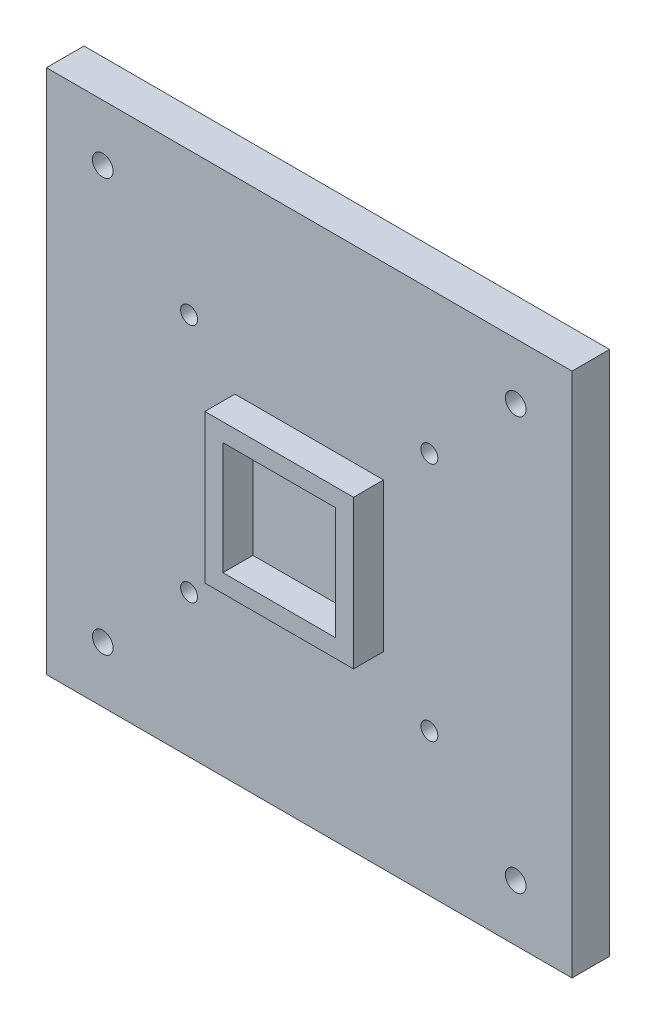
from build123d import *

# Parameters (mm, degrees)
SKETCH_1_W            = 140
SKETCH_1_H            = 140
EXTRUDE_140X140_DEPTH = 10
EXTRUDE_START         = 10
SKETCH_2_W            = 39.6
SKETCH_2_H            = 39.6
SKETCH_2_W_2          = 30
SKETCH_2_H_2          = 30
EXTRUDE_39P6_DEPTH    = 8
M5_M4_DEPTH           = 101.618089825
M5_M4_DEPTH_BACK      = 101.618089825
SKETCH_3_R            = 2.75
SKETCH_3_R_2          = 2.25


with BuildPart() as part:
    # 草图1 → 锚固底板140x140 (new body)
    with BuildSketch(Plane.XY):
        Rectangle(SKETCH_1_W, SKETCH_1_H)
    extrude(amount=EXTRUDE_140X140_DEPTH)

    # 草图2 → 立柱定位凸台39p6 (add)
    with BuildSketch(Plane.XY.offset(EXTRUDE_START)):
        Rectangle(SKETCH_2_W, SKETCH_2_H)
        Rectangle(SKETCH_2_W_2, SKETCH_2_H_2, mode=Mode.SUBTRACT)
    extrude(amount=EXTRUDE_39P6_DEPTH)

    # 草图3 → 桌面M5与立柱M4通孔 (cut, two sides: drawn at the far end of the back side and taken through both)
    with BuildSketch(Plane.XY.offset(-M5_M4_DEPTH_BACK)):
        with Locations((-55, -55)):
            Circle(SKETCH_3_R)
        with Locations((-55, 55)):
            Circle(SKETCH_3_R)
        with Locations((55, -55)):
            Circle(SKETCH_3_R)
        with Locations((55, 55)):
            Circle(SKETCH_3_R)
        with Locations((-32, -32)):
            Circle(SKETCH_3_R_2)
        with Locations((-32, 32)):
            Circle(SKETCH_3_R_2)
        with Locations((32, -32)):
            Circle(SKETCH_3_R_2)
        with Locations((32, 32)):
            Circle(SKETCH_3_R_2)
    extrude(amount=M5_M4_DEPTH + M5_M4_DEPTH_BACK, mode=Mode.SUBTRACT)


solid = part.part
